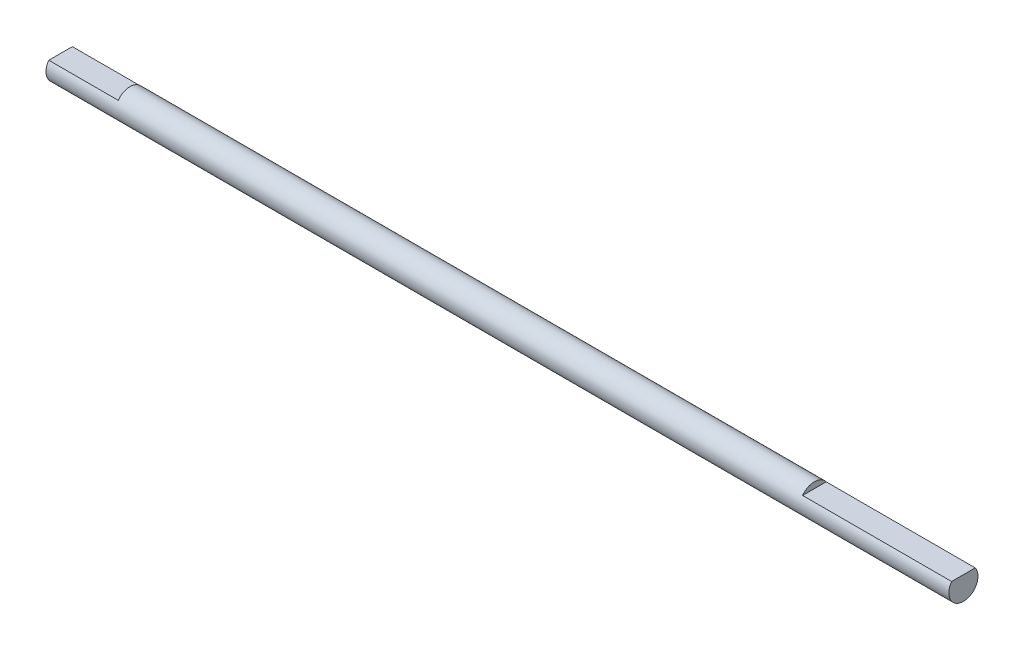
from build123d import *

# Parameters (mm, degrees)
SKETCH1_R               = 4
BOSS_EXTRUDE1_DEPTH     = 123.825
CUT_EXTRUDE1_DEPTH      = 124.954147268
CUT_EXTRUDE1_DEPTH_BACK = 124.954147268
SKETCH3_W               = 19.05
SKETCH3_H               = 1.65
SKETCH3_W_2             = 40.878125


with BuildPart() as part:
    # Sketch1 → Boss-Extrude1 (new, symmetric)
    with BuildSketch(Plane(origin=(0, 0, 0), x_dir=(0, 0, -1), z_dir=(1, 0, 0))):
        Circle(SKETCH1_R)
    extrude(amount=BOSS_EXTRUDE1_DEPTH, both=True)

    # Sketch3 → Cut-Extrude1 (cut, two sides: drawn at the far end of the back side and taken through both)
    with BuildSketch(Plane.XY.offset(-CUT_EXTRUDE1_DEPTH_BACK)):
        with Locations((-114.3, 3.175)):
            Rectangle(SKETCH3_W, SKETCH3_H)
        with Locations((103.3859375, 3.175)):
            Rectangle(SKETCH3_W_2, SKETCH3_H)
    extrude(amount=CUT_EXTRUDE1_DEPTH + CUT_EXTRUDE1_DEPTH_BACK, mode=Mode.SUBTRACT)


solid = part.part
